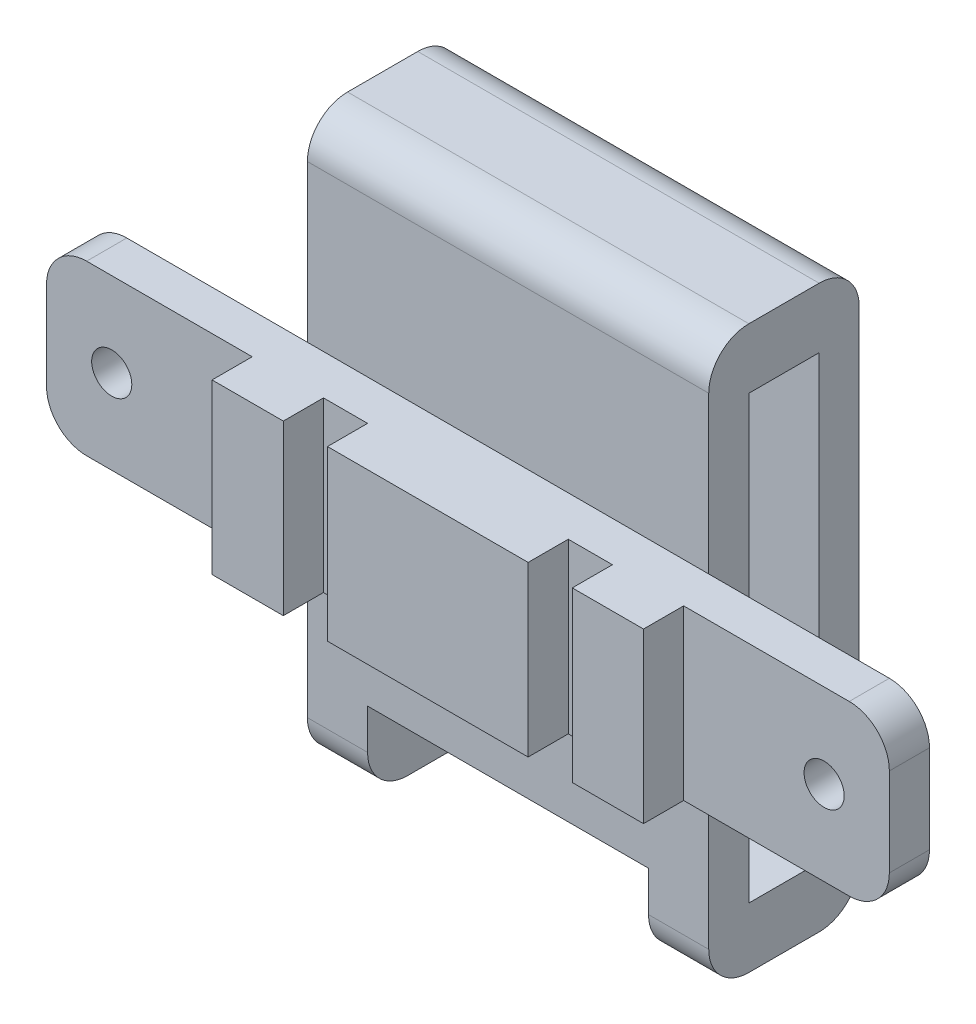
from build123d import *

# Parameters (mm, degrees)
SKETCH2_W           = 42
SKETCH2_H           = 8.4
BOSS_EXTRUDE1_DEPTH = 2
SKETCH3_W           = 3.55
SKETCH3_H           = 8.4
SKETCH3_W_2         = 10
BOSS_EXTRUDE2_DEPTH = 2
FILLET1_R           = 2
SKETCH4_R           = 1
CUT_EXTRUDE1_DEPTH  = 2
SKETCH5_W           = 20
SKETCH5_H           = 28
BOSS_EXTRUDE3_DEPTH = 7.5
FILLET2_R           = 2
SKETCH6_W           = 3.5
SKETCH6_H           = 22
CUT_EXTRUDE2_DEPTH  = 20
SKETCH7_W           = 14
SKETCH7_H           = 4
CUT_EXTRUDE3_DEPTH  = 10


with BuildPart() as part:
    # Sketch2 → Boss-Extrude1 (new body)
    with BuildSketch(Plane.XY):
        Rectangle(SKETCH2_W, SKETCH2_H)
    extrude(amount=BOSS_EXTRUDE1_DEPTH)

    # Sketch3 → Boss-Extrude2 (add)
    with BuildSketch(Plane.XY.offset(2)):
        with Locations((-8.975, 0)):
            Rectangle(SKETCH3_W, SKETCH3_H)
        with Locations((8.975, 0)):
            Rectangle(SKETCH3_W, SKETCH3_H)
        Rectangle(SKETCH3_W_2, SKETCH3_H)
    extrude(amount=BOSS_EXTRUDE2_DEPTH)

    # Fillet1
    fillet1_edges = [part.edges().sort_by_distance(p)[0] for p in [
        (-21, 4.2, 1),
        (21, 4.2, 1),
        (21, -4.2, 1),
        (-21, -4.2, 1),
    ]]
    fillet(fillet1_edges, radius=FILLET1_R)

    # Sketch4 → Cut-Extrude1 (cut)
    with BuildSketch(Plane.XY.offset(2)):
        with Locations((-17.75, 0)):
            Circle(SKETCH4_R)
        with Locations((17.75, 0)):
            Circle(SKETCH4_R)
    extrude(amount=-CUT_EXTRUDE1_DEPTH, mode=Mode.SUBTRACT)

    # Sketch5 → Boss-Extrude3 (add)
    with BuildSketch(Plane(origin=(0, 0, 0), x_dir=(-1, 0, 0), z_dir=(0, 0, -1))):
        Rectangle(SKETCH5_W, SKETCH5_H)
    extrude(amount=BOSS_EXTRUDE3_DEPTH)

    # Fillet2
    fillet2_edges = [part.edges().sort_by_distance(p)[0] for p in [
        (0, 14, 0),
        (0, -14, 0),
        (0, 14, -7.5),
        (0, -14, -7.5),
    ]]
    fillet(fillet2_edges, radius=FILLET2_R)

    # Sketch6 → Cut-Extrude2 (cut)
    with BuildSketch(Plane.ZY.offset(10)):
        with Locations((-3.75, 0)):
            Rectangle(SKETCH6_W, SKETCH6_H)
    extrude(amount=-CUT_EXTRUDE2_DEPTH, mode=Mode.SUBTRACT)

    # Sketch7 → Cut-Extrude3 (cut)
    with BuildSketch(Plane.XY):
        with Locations((0, -12)):
            Rectangle(SKETCH7_W, SKETCH7_H)
    extrude(amount=-CUT_EXTRUDE3_DEPTH, mode=Mode.SUBTRACT)


solid = part.part
